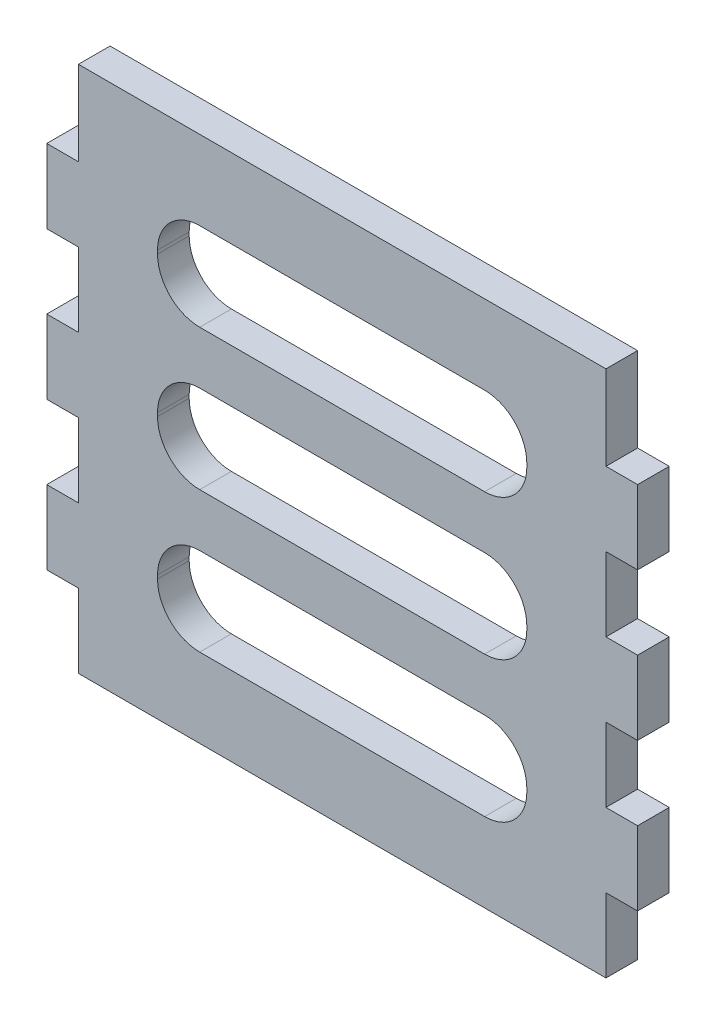
from build123d import *

# Parameters (mm, degrees)
BOSS_EXTRUDE1_DEPTH = 3


with BuildPart() as part:
    # Sketch1 → Boss-Extrude1 (new body)
    with BuildSketch(Plane.XY):
        Polygon((0, 0), (0, 7), (3, 7), (3, 14), (0, 14), (0, 21), (3, 21), (3, 28), (0, 28), (0, 35), (3, 35), (3, 42), (0, 42), (0, 50), (-50, 50), (-50, 42), (-53, 42), (-53, 35), (-50, 35), (-50, 28), (-53, 28), (-53, 21), (-50, 21), (-50, 14), (-53, 14), (-53, 7), (-50, 7), (-50, 0), align=None)
        with BuildLine():
            Line((-38.5, 42.5), (-11.5, 42.5))
            ThreePointArc((-11.5, 42.5), (-8.671572875, 41.328427125), (-7.5, 38.5))
            Line((-7.5, 38.5), (-7.5, 38.166666667))
            ThreePointArc((-7.5, 38.166666667), (-8.671572875, 35.338239542), (-11.5, 34.166666667))
            Line((-11.5, 34.166666667), (-38.5, 34.166666667))
            ThreePointArc((-38.5, 34.166666667), (-41.328427125, 35.338239542), (-42.5, 38.166666667))
            Line((-42.5, 38.166666667), (-42.5, 38.5))
            ThreePointArc((-42.5, 38.5), (-41.328427125, 41.328427125), (-38.5, 42.5))
        make_face(mode=Mode.SUBTRACT)
        with BuildLine():
            Line((-38.5, 29.166666667), (-11.5, 29.166666667))
            ThreePointArc((-11.5, 29.166666667), (-8.671572875, 27.995093791), (-7.5, 25.166666667))
            Line((-7.5, 25.166666667), (-7.5, 24.833333333))
            ThreePointArc((-7.5, 24.833333333), (-8.671572875, 22.004906209), (-11.5, 20.833333333))
            Line((-11.5, 20.833333333), (-38.5, 20.833333333))
            ThreePointArc((-38.5, 20.833333333), (-41.328427125, 22.004906209), (-42.5, 24.833333333))
            Line((-42.5, 24.833333333), (-42.5, 25.166666667))
            ThreePointArc((-42.5, 25.166666667), (-41.328427125, 27.995093791), (-38.5, 29.166666667))
        make_face(mode=Mode.SUBTRACT)
        with BuildLine():
            Line((-11.5, 15.833333333), (-38.5, 15.833333333))
            ThreePointArc((-38.5, 15.833333333), (-41.328427125, 14.661760458), (-42.5, 11.833333333))
            Line((-42.5, 11.833333333), (-42.5, 11.5))
            ThreePointArc((-42.5, 11.5), (-41.328427125, 8.671572875), (-38.5, 7.5))
            Line((-38.5, 7.5), (-11.5, 7.5))
            ThreePointArc((-11.5, 7.5), (-8.671572875, 8.671572875), (-7.5, 11.5))
            Line((-7.5, 11.5), (-7.5, 11.833333333))
            ThreePointArc((-7.5, 11.833333333), (-8.671572875, 14.661760458), (-11.5, 15.833333333))
        make_face(mode=Mode.SUBTRACT)
    extrude(amount=BOSS_EXTRUDE1_DEPTH)


solid = part.part
